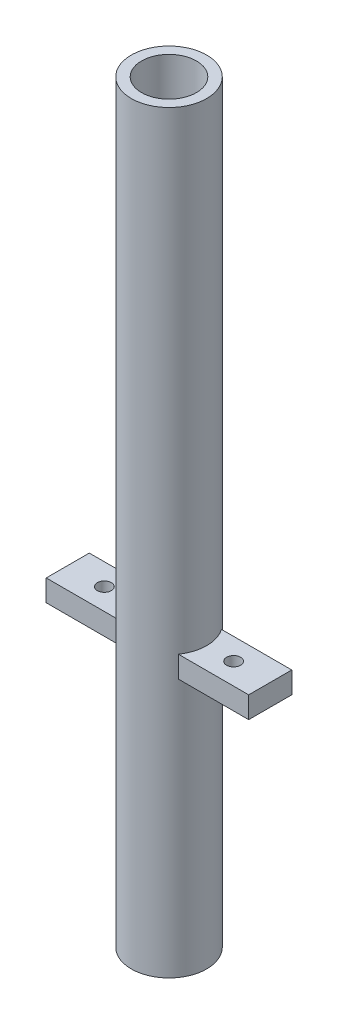
from build123d import *

# Parameters (mm, degrees)
SKETCH1_R           = 17.5
SKETCH1_R_2         = 12.75
BOSS_EXTRUDE1_DEPTH = 175
SKETCH3_R           = 3.25
BOSS_EXTRUDE2_DEPTH = 10


with BuildPart() as part:
    # Sketch1 → Boss-Extrude1 (new, symmetric)
    with BuildSketch(Plane(origin=(0, 0, 0), x_dir=(1, 0, 0), z_dir=(0, 1, 0))):
        with Locations(Location((0, 0, 0), (0, 0, 270))):
            Circle(SKETCH1_R)
        with Locations(Location((0, 0, 0), (0, 0, 270))):
            Circle(SKETCH1_R_2, mode=Mode.SUBTRACT)
    extrude(amount=BOSS_EXTRUDE1_DEPTH, both=True)

    # Sketch3 → Boss-Extrude2 (add)
    # profile 1 of 2: a face of its own
    with BuildSketch(Plane(origin=(0, -55, 0), x_dir=(-1, 0, 0), z_dir=(0, -1, 0))):
        with BuildLine():
            Line((47, -10), (7.90964601, -10))
            ThreePointArc((7.90964601, -10), (12.75, 0), (7.90964601, 10))
            Line((7.90964601, 10), (47, 10))
            Line((47, 10), (47, -10))
        make_face()
        with Locations(Location((30, 0, 0), (0, 0, 270))):
            Circle(SKETCH3_R, mode=Mode.SUBTRACT)
    # profile 2 of 2: a face of its own
    with BuildSketch(Plane(origin=(0, -55, 0), x_dir=(-1, 0, 0), z_dir=(0, -1, 0))):
        with BuildLine():
            Line((-47, -10), (-47, 10))
            Line((-47, 10), (-7.90964601, 10))
            ThreePointArc((-7.90964601, 10), (-12.75, 0), (-7.90964601, -10))
            Line((-7.90964601, -10), (-47, -10))
        make_face()
        with Locations(Location((-30, 0, 0), (0, 0, 90))):
            Circle(SKETCH3_R, mode=Mode.SUBTRACT)
    extrude(amount=-BOSS_EXTRUDE2_DEPTH)


solid = part.part
